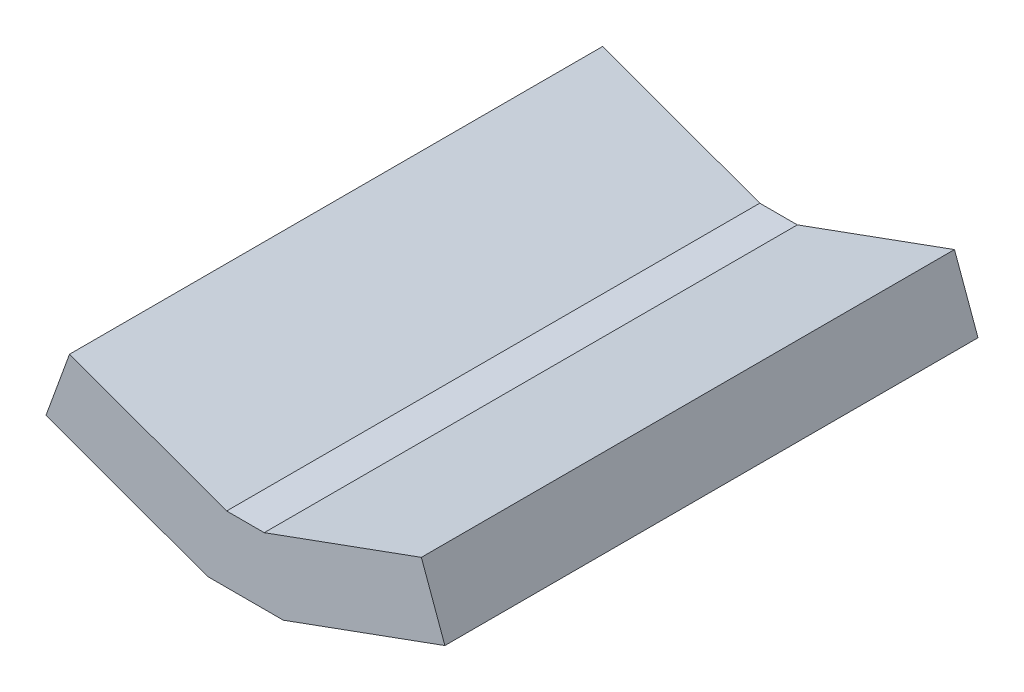
from build123d import *

# Parameters (mm, degrees)
BOSS_EXTRUDE2_DEPTH      = 77.5
BOSS_EXTRUDE2_DEPTH_BACK = 77.5


with BuildPart() as part:
    # Sketch7 → Boss-Extrude2 (new, two sides: drawn at the far end of the back side and taken through both)
    with BuildSketch(Plane.XY.offset(-BOSS_EXTRUDE2_DEPTH_BACK)):
        Polygon((-11, 0), (11, 0), (57.984631039, 17.101007166), (51.144228173, 35.894859582), (5.462206168, 19.267963331), (-5.462206168, 19.267963331), (-51.144228173, 35.894859582), (-57.984631039, 17.101007166), align=None)
    extrude(amount=BOSS_EXTRUDE2_DEPTH + BOSS_EXTRUDE2_DEPTH_BACK)


solid = part.part
